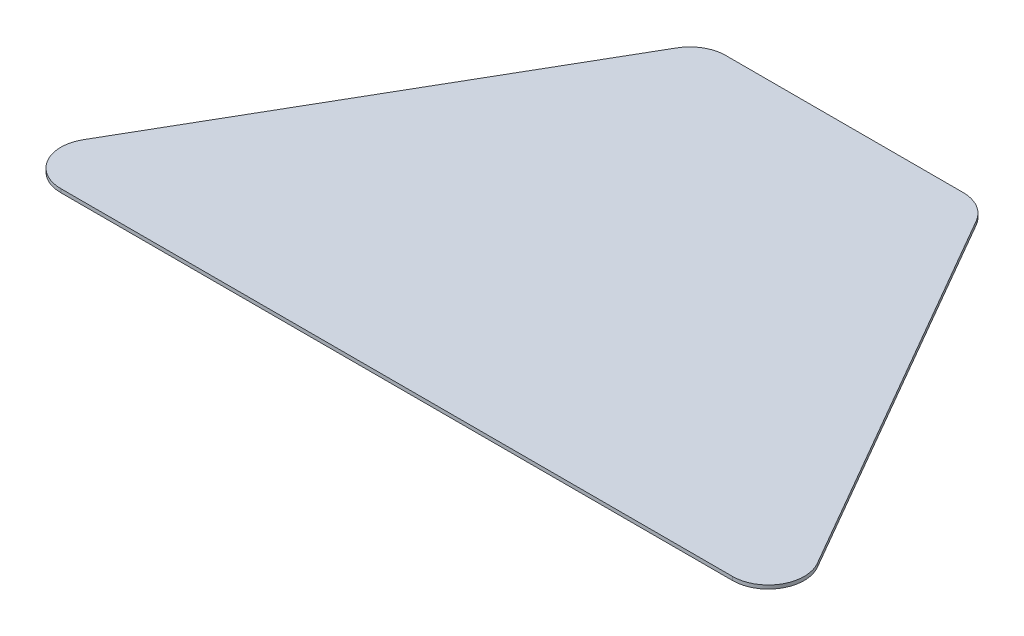
from build123d import *

# Parameters (mm, degrees)
BOSS_EXTRUDE1_DEPTH = 0.1
FILLET5_R           = 2


with BuildPart() as part:
    # Sketch1 → Boss-Extrude1 (new, symmetric)
    with BuildSketch(Plane(origin=(0, 0, 0), x_dir=(1, 0, 0), z_dir=(0, 1, 0))):
        Polygon((-14.297771125, -12.5), (14.297771125, -12.5), (22.216878365, -12.5), (7.783121635, 12.5), (-7.783121635, 12.5), (-22.216878365, -12.5), align=None)
    extrude(amount=BOSS_EXTRUDE1_DEPTH, both=True)

    # Fillet5
    fillet5_edges = [part.edges().sort_by_distance(p)[0] for p in [
        (-22.216878365, 0, 12.5),
        (-7.783121635, 0, -12.5),
        (7.783121635, 0, -12.5),
        (22.216878365, 0, 12.5),
    ]]
    fillet(fillet5_edges, radius=FILLET5_R)


solid = part.part
